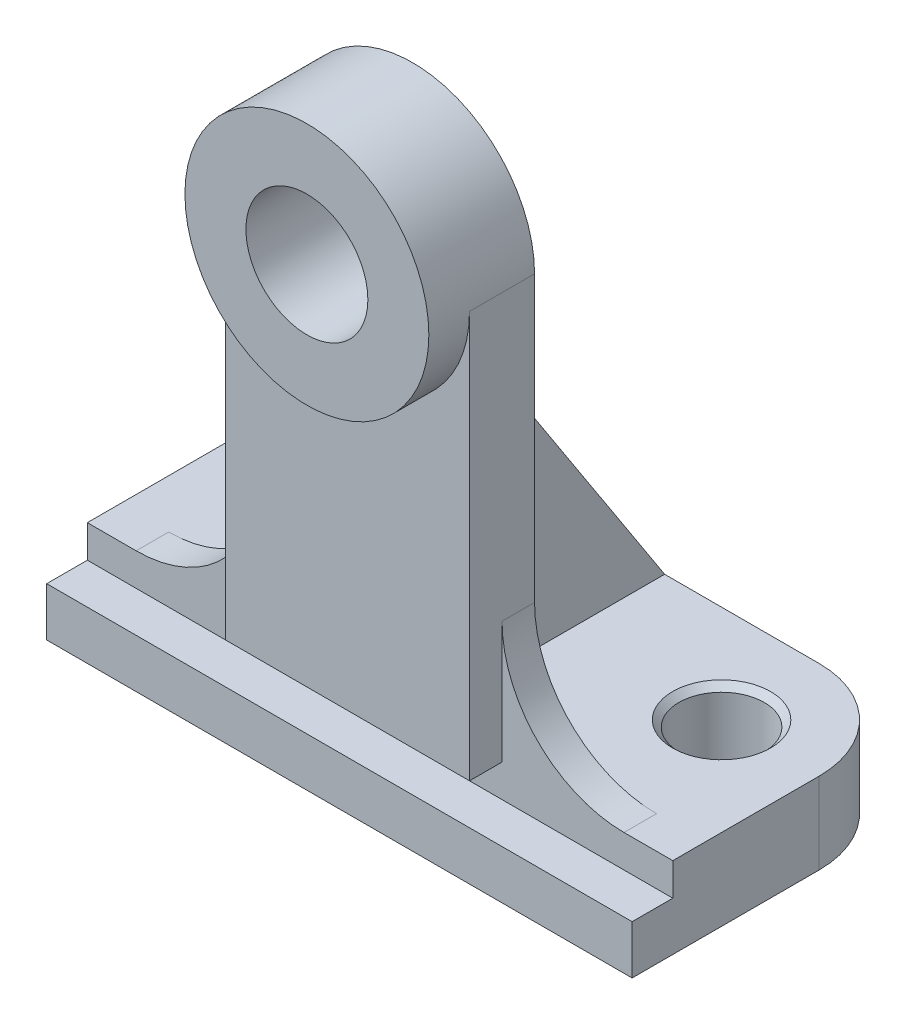
from build123d import *

# Parameters (mm, degrees)
BOSS_EXTRUDE1_DEPTH              = 36
SKETCH2_R                        = 7.5
BOSS_EXTRUDE2_DEPTH              = 4
SKETCH3_R                        = 15
SKETCH3_R_2                      = 7.5
BOSS_EXTRUDE3_DEPTH              = 5
FILLET2_R                        = 15
RIB1_REACH                       = 83.598
SKETCH4_WALL_W                   = 212.903642704
SKETCH4_WALL_H                   = 10
FILLET3_R                        = 12
M12X1_5_TAPPED_HOLE1_D           = 10.5
M12X1_5_TAPPED_HOLE1_CSINK_D     = 12.05
M12X1_5_TAPPED_HOLE1_CSINK_ANGLE = 90


with BuildPart() as part:
    # Sketch1 → Boss-Extrude1 (new, symmetric)
    with BuildSketch(Plane(origin=(0, 0, 0), x_dir=(0, 0, -1), z_dir=(1, 0, 0))):
        Polygon((-17.5, 1), (-17.5, -5), (17.5, -5), (17.5, 5), (-12.5, 5), (-12.5, 1), align=None)
    extrude(amount=BOSS_EXTRUDE1_DEPTH, both=True)

    # Sketch2 → Boss-Extrude2 (add, symmetric)
    with BuildSketch(Plane.XY.offset(12.5)):
        with BuildLine():
            ThreePointArc((15, 55), (0, 70), (-15, 55))
            Line((-15, 55), (-15, 5))
            Line((-15, 5), (15, 5))
            Line((15, 5), (15, 55))
        make_face()
        with Locations((0, 55)):
            Circle(SKETCH2_R, mode=Mode.SUBTRACT)
    extrude(amount=BOSS_EXTRUDE2_DEPTH, both=True)

    # Sketch3 → Boss-Extrude3 (add)
    with BuildSketch(Plane.XY.offset(16.5)):
        with Locations((0, 55)):
            Circle(SKETCH3_R)
        with Locations((0, 55)):
            Circle(SKETCH3_R_2, mode=Mode.SUBTRACT)
    extrude(amount=BOSS_EXTRUDE3_DEPTH)

    # Fillet2
    fillet2_edges = [part.edges().sort_by_distance(p)[0] for p in [
        (-15, 5, 10.5),
        (15, 5, 10.5),
    ]]
    fillet(fillet2_edges, radius=FILLET2_R)

    # Sketch4 wall → Rib1 (add, up to next)
    with BuildSketch(Plane(origin=(0, 25, -4.5), x_dir=(0, 0.838443616301, 0.544988350595), z_dir=(0, -0.544988350595, 0.838443616301)), mode=Mode.PRIVATE) as rib1_sk1:
        Rectangle(SKETCH4_WALL_W, SKETCH4_WALL_H)
    rib1_tool1 = extrude(rib1_sk1.sketch, amount=RIB1_REACH, mode=Mode.PRIVATE) - part.part
    add(rib1_tool1.solids().sort_by_distance((0, 25, -4.5))[0])

    # Fillet3
    fillet3_edges = [part.edges().sort_by_distance(p)[0] for p in [
        (36, 0, -17.5),
        (-36, 0, -17.5),
    ]]
    fillet(fillet3_edges, radius=FILLET3_R)

    # M12x1.5 Tapped Hole1 (through all)
    with Locations(Plane(origin=(0, 5, 0), x_dir=(1, 0, 0), z_dir=(0, 1, 0))):
        with Locations((24, 5.5), (-24, 5.5)):
            CounterSinkHole(M12X1_5_TAPPED_HOLE1_D / 2, M12X1_5_TAPPED_HOLE1_CSINK_D / 2, counter_sink_angle=M12X1_5_TAPPED_HOLE1_CSINK_ANGLE)


solid = part.part
